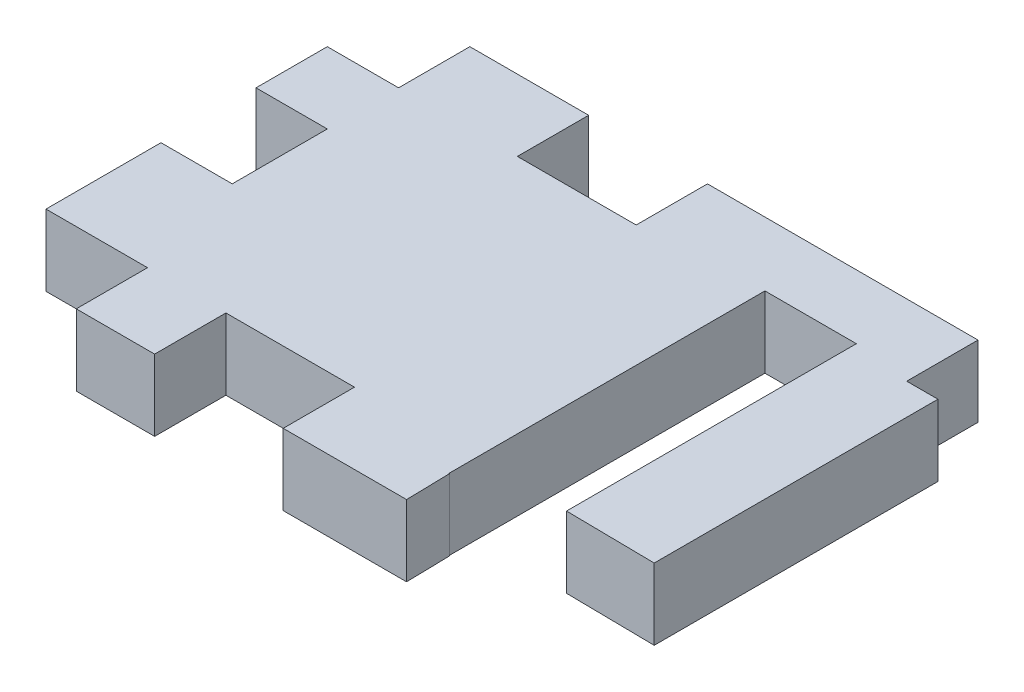
from build123d import *

# Parameters (mm, degrees)
SKETCH1_W           = 30
SKETCH1_H           = 30
BOSS_EXTRUDE1_DEPTH = 3
SKETCH2_W           = 5
SKETCH2_H           = 3
SKETCH2_W_2         = 1.313790547
SKETCH2_W_3         = 3
SKETCH2_H_2         = 4
CUT_EXTRUDE1_DEPTH  = 3
SKETCH3_W           = 3.847981768
SKETCH3_H           = 13.294575909
CUT_EXTRUDE2_DEPTH  = 3
CUT_EXTRUDE3_DEPTH  = 3
CUT_EXTRUDE4_DEPTH  = 10


with BuildPart() as part:
    # Sketch1 → Boss-Extrude1 (new body)
    with BuildSketch(Plane(origin=(0, 0, 0), x_dir=(1, 0, 0), z_dir=(0, 1, 0))):
        with Locations((15, -15)):
            Rectangle(SKETCH1_W, SKETCH1_H)
    extrude(amount=BOSS_EXTRUDE1_DEPTH)

    # Sketch2 → Cut-Extrude1 (cut)
    with BuildSketch(Plane.XZ):
        with Locations((10.5, 1.5)):
            Rectangle(SKETCH2_W, SKETCH2_H)
        with Locations((25.043104727, 1.5)):
            Rectangle(SKETCH2_W_2, SKETCH2_H)
        with Locations((1.5, 1.5)):
            Rectangle(SKETCH2_W_3, SKETCH2_H)
        with Locations((1.5, 8)):
            Rectangle(SKETCH2_W_3, SKETCH2_H_2)
    extrude(amount=-CUT_EXTRUDE1_DEPTH, mode=Mode.SUBTRACT)

    # Sketch3 → Cut-Extrude2 (cut)
    with BuildSketch(Plane.XZ):
        with Locations((20.035652011, 9.340199914)):
            Rectangle(SKETCH3_W, SKETCH3_H)
    extrude(amount=-CUT_EXTRUDE2_DEPTH, mode=Mode.SUBTRACT)

    # Sketch4 → Cut-Extrude3 (cut)
    with BuildSketch(Plane.XZ):
        Polygon((0, 14.83898954), (4.273286448, 14.83898954), (4.273286448, 17.83898954), (7.572046642, 17.83898954), (7.572046642, 14.83898954), (12.983097177, 14.83898954), (12.983097177, 17.83898954), (18.173549861, 17.83898954), (18.111661127, 14.83898954), (30, 15), (30, 36.64216365), (-3.662569557, 36.64216365), (-3.662569557, 14.83898954), align=None)
    extrude(amount=-CUT_EXTRUDE3_DEPTH, mode=Mode.SUBTRACT)

    # Sketch6 → Cut-Extrude4 (cut)
    with BuildSketch(Plane(origin=(0, 3, 0), x_dir=(1, 0, 0), z_dir=(0, 1, 0))):
        Polygon((25.7, 0), (25.7, -20.065163227), (34.530029549, -19.489635477), (33.156944601, 1.576908509), (28.640882237, 2.839466423), align=None)
    extrude(amount=-CUT_EXTRUDE4_DEPTH, mode=Mode.SUBTRACT)


solid = part.part
